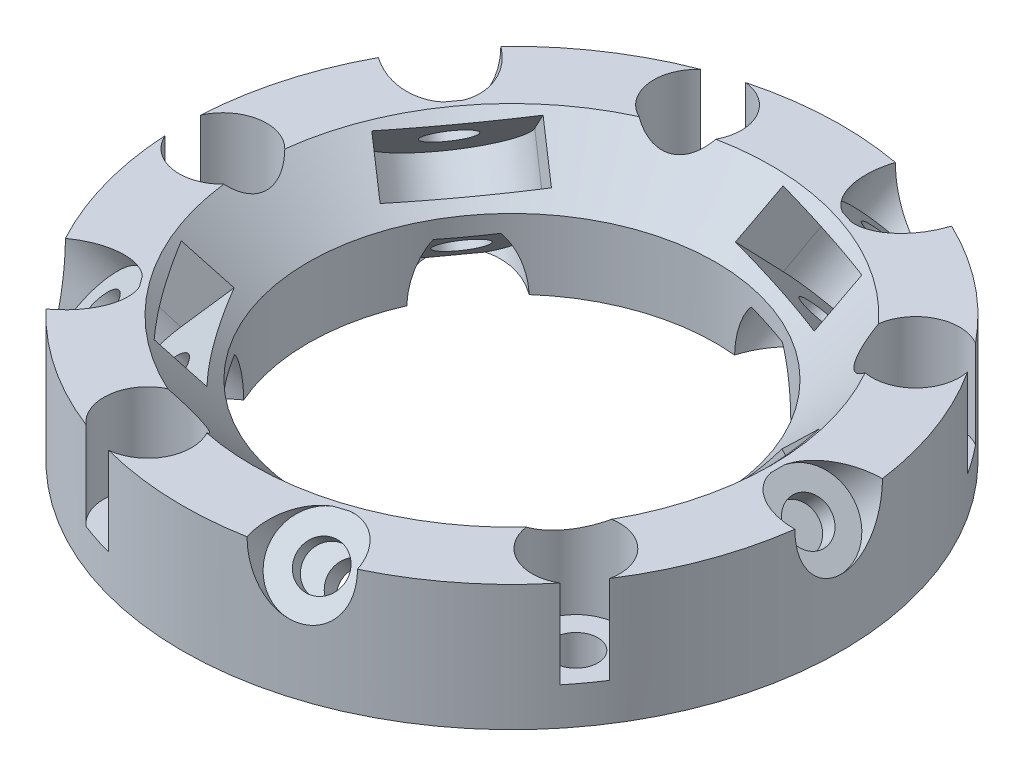
from build123d import *

# Parameters (mm, degrees)
CUT_EXTRUDE1_START = -5.5
SKETCH3_R          = 2.5
CUT_EXTRUDE1_DEPTH = 6
SKETCH3_2_R        = 2.5
CUT_EXTRUDE2_DEPTH = 75.468538091
CUT_EXTRUDE3_START = -3
SKETCH5_R          = 5
CUT_EXTRUDE3_DEPTH = 5.5
CUT_EXTRUDE4_START = 13.5
SKETCH5_2_R        = 5
CUT_EXTRUDE4_DEPTH = 5.5
CIRPATTERN1_COUNT  = 5
SKETCH6_R          = 2.5
CUT_EXTRUDE5_DEPTH = 30.2
CUT_EXTRUDE6_START = 12
SKETCH7_R          = 5
CUT_EXTRUDE6_DEPTH = 46.59973029
CIRPATTERN2_COUNT  = 5


with BuildPart() as part:
    # Sketch2 → Revolve1 (revolve)
    with BuildSketch(Plane.XY):
        Polygon((23.257359313, 7.70414766), (23.257359313, 15.70414766), (29.621320344, 22.068108691), (37.621320344, 22.068108691), (37.621320344, 7.70414766), align=None)
    revolve(axis=Axis((0, 55, 0), (0, -1, 0)))

    # Sketch3 → Cut-Extrude1 (cut)
    with BuildSketch(Plane(origin=(24.430500955, 24.430500955, 0), x_dir=(0.7071067811865489, -0.7071067811865461, 0), z_dir=(0.7071067811865461, 0.7071067811865489, 0)).offset(CUT_EXTRUDE1_START)):
        with BuildLine():
            Line((10.780267008, -7), (3.780267008, -7))
            Line((3.780267008, -7), (3.780267008, 7))
            Line((3.780267008, 7), (10.780267008, 7))
            ThreePointArc((10.780267008, 7), (17.780267008, 0), (10.780267008, -7))
        make_face()
        with Locations((10.780267008, 0)):
            Circle(SKETCH3_R, mode=Mode.SUBTRACT)
    cut_extrude1 = extrude(amount=CUT_EXTRUDE1_DEPTH, mode=Mode.SUBTRACT)

    # Sketch3<2> → Cut-Extrude2 (cut, symmetric)
    with BuildSketch(Plane(origin=(24.430500955, 24.430500955, 0), x_dir=(0.7071067811865489, -0.7071067811865461, 0), z_dir=(0.7071067811865461, 0.7071067811865489, 0))):
        with Locations((10.780267008, 0)):
            Circle(SKETCH3_2_R)
    cut_extrude2 = extrude(amount=CUT_EXTRUDE2_DEPTH, both=True, mode=Mode.SUBTRACT)

    # Sketch5 → Cut-Extrude3 (cut)
    with BuildSketch(Plane(origin=(20.541413658, 20.541413658, 0), x_dir=(0, 0, -1), z_dir=(0.7071067811865461, 0.7071067811865489, 0)).offset(CUT_EXTRUDE3_START)):
        with Locations((0, -10.780267008)):
            Circle(SKETCH5_R)
    cut_extrude3 = extrude(amount=-CUT_EXTRUDE3_DEPTH, mode=Mode.SUBTRACT)

    # Sketch5<2> → Cut-Extrude4 (cut)
    with BuildSketch(Plane(origin=(20.541413658, 20.541413658, 0), x_dir=(0, 0, -1), z_dir=(0.7071067811865461, 0.7071067811865489, 0)).offset(CUT_EXTRUDE4_START)):
        with Locations((0, -10.780267008)):
            Circle(SKETCH5_2_R)
    cut_extrude4 = extrude(amount=-CUT_EXTRUDE4_DEPTH, mode=Mode.SUBTRACT)

    # CirPattern1: Cut-Extrude1, Cut-Extrude2, Cut-Extrude3, Cut-Extrude4 ×5 about axis
    cirpattern1_axis = Axis((0, 55, 0), (0, -1, 0))
    add([cut_extrude1.rotate(cirpattern1_axis, i * 360 / CIRPATTERN1_COUNT) for i in range(1, CIRPATTERN1_COUNT)], mode=Mode.SUBTRACT)
    add([cut_extrude2.rotate(cirpattern1_axis, i * 360 / CIRPATTERN1_COUNT) for i in range(1, CIRPATTERN1_COUNT)], mode=Mode.SUBTRACT)
    add([cut_extrude3.rotate(cirpattern1_axis, i * 360 / CIRPATTERN1_COUNT) for i in range(1, CIRPATTERN1_COUNT)], mode=Mode.SUBTRACT)
    add([cut_extrude4.rotate(cirpattern1_axis, i * 360 / CIRPATTERN1_COUNT) for i in range(1, CIRPATTERN1_COUNT)], mode=Mode.SUBTRACT)

    # Sketch6 → Cut-Extrude5 (cut)
    with BuildSketch(Plane(origin=(0, 0, 0), x_dir=(1, 0, 0), z_dir=(0, 1, 0))):
        with Locations((-33, 0)):
            Circle(SKETCH6_R)
    cut_extrude5 = extrude(amount=CUT_EXTRUDE5_DEPTH, mode=Mode.SUBTRACT)

    # Sketch7 → Cut-Extrude6 (cut, through all)
    with BuildSketch(Plane(origin=(0, 0, 0), x_dir=(1, 0, 0), z_dir=(0, 1, 0)).offset(CUT_EXTRUDE6_START)):
        with Locations((-33, 0)):
            Circle(SKETCH7_R)
    cut_extrude6 = extrude(amount=CUT_EXTRUDE6_DEPTH, mode=Mode.SUBTRACT)

    # CirPattern2: Cut-Extrude5, Cut-Extrude6 ×5 about axis
    cirpattern2_axis = Axis((0, 55, 0), (0, -1, 0))
    add([cut_extrude5.rotate(cirpattern2_axis, i * 360 / CIRPATTERN2_COUNT) for i in range(1, CIRPATTERN2_COUNT)], mode=Mode.SUBTRACT)
    add([cut_extrude6.rotate(cirpattern2_axis, i * 360 / CIRPATTERN2_COUNT) for i in range(1, CIRPATTERN2_COUNT)], mode=Mode.SUBTRACT)


solid = part.part
